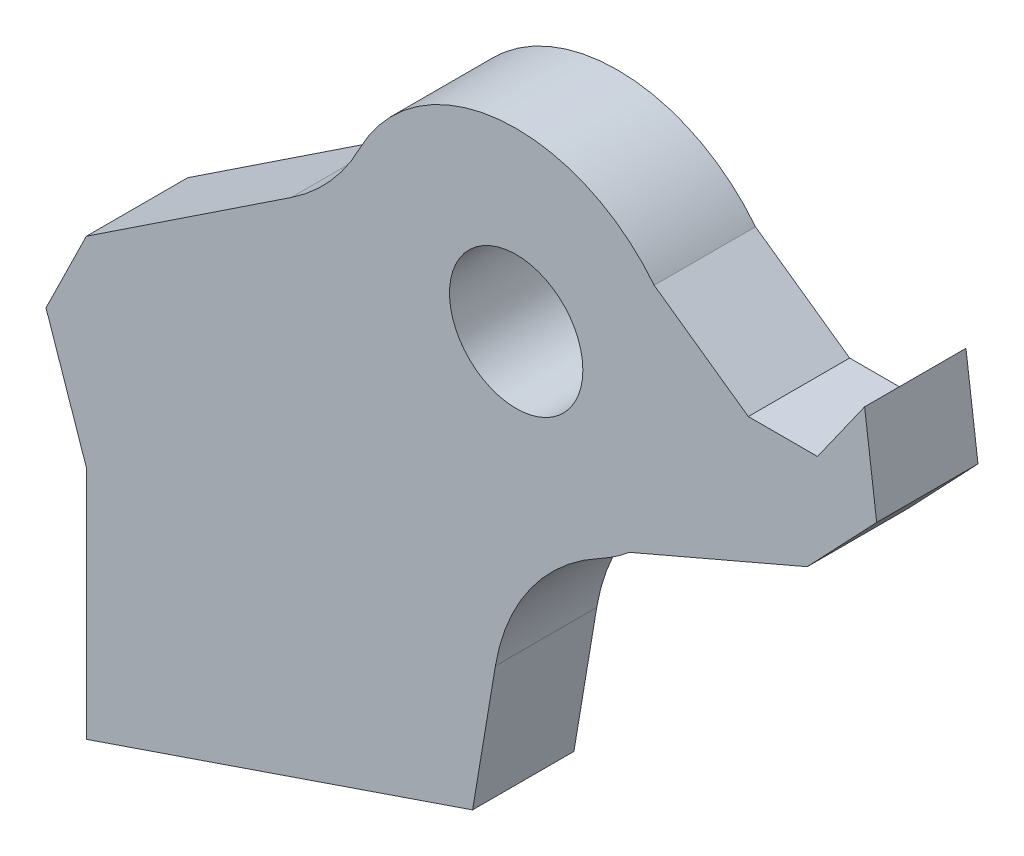
from build123d import *

# Parameters (mm, degrees)
BOSS_EXTRUDE1_DEPTH      = 3.175
BOSS_EXTRUDE1_DEPTH_BACK = 3.175
SKETCH1_R                = 4.178670833


with BuildPart() as part:
    # Sketch1 → Boss-Extrude1 (new, two sides: drawn at the far end of the back side and taken through both)
    with BuildSketch(Plane.XY.offset(-BOSS_EXTRUDE1_DEPTH_BACK)):
        with BuildLine():
            Line((609.146322902, 148.588119322), (596.301932932, 140.061825094))
            Line((596.301932932, 140.061825094), (593.775672351, 134.913286528))
            Line((593.775672351, 134.913286528), (596.301932932, 127.519508045))
            Line((596.301932932, 127.519508045), (596.301932932, 112.761180415))
            Line((596.301932932, 112.761180415), (620.507043959, 121.0314333))
            Line((620.507043959, 121.0314333), (621.935426787, 129.559046913))
            ThreePointArc((621.935426787, 129.559046913), (624.139317927, 134.860628873), (628.452705625, 138.649902417))
            ThreePointArc((628.452705625, 138.649902417), (629.422874429, 139.237084375), (630.327572389, 139.920847318))
            Line((630.327572389, 139.920847318), (641.475190915, 144.713939185))
            Line((641.475190915, 144.713939185), (645.828084101, 149.293372969))
            Line((645.828084101, 149.293372969), (645.073577651, 155.192660049))
            Line((645.073577651, 155.192660049), (642.120102738, 151.018989056))
            Line((642.120102738, 151.018989056), (637.784779863, 151.018989056))
            Line((637.784779863, 151.018989056), (631.886802035, 155.192660049))
            ThreePointArc((631.886802035, 155.192660049), (622.162679723, 159.329151932), (613.427511309, 153.382223935))
            ThreePointArc((613.427511309, 153.382223935), (611.595219928, 150.709853801), (609.146322902, 148.588119322))
        make_face()
        with Locations((623.238490422, 148.360136067)):
            Circle(SKETCH1_R, mode=Mode.SUBTRACT)
    extrude(amount=BOSS_EXTRUDE1_DEPTH + BOSS_EXTRUDE1_DEPTH_BACK)


solid = part.part
